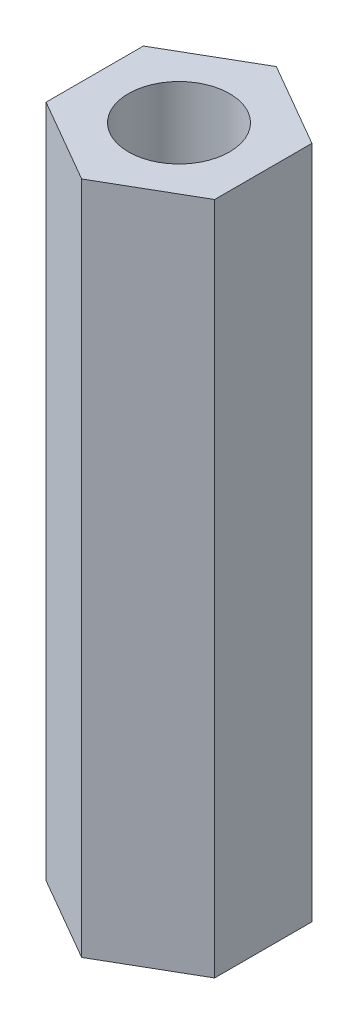
from build123d import *

# Parameters (mm, degrees)
EXTRUDE_1_DEPTH     = 20
CUT_EXTRUDE_1_REACH = 22.361
SKETCH_2_R          = 1.5


with BuildPart() as part:
    # 草圖1 → 填料-伸長1 (new body)
    with BuildSketch(Plane(origin=(0, 0, 0), x_dir=(1, 0, 0), z_dir=(0, 1, 0))):
        Polygon((0, 2.886751346), (-2.5, 1.443375673), (-2.5, -1.443375673), (0, -2.886751346), (2.5, -1.443375673), (2.5, 1.443375673), align=None)
    extrude(amount=EXTRUDE_1_DEPTH)

    # 草圖2 → 除料-伸長1 (cut, up to next)
    with BuildSketch(Plane(origin=(0, 20, 0), x_dir=(-1, 0, 0), z_dir=(0, 1, 0)), mode=Mode.PRIVATE) as cut_extrude_1_sk1:
        with Locations(Location((0, 0, 0), (0, 0, 90))):
            Circle(SKETCH_2_R)
    cut_extrude_1_tool1 = extrude(cut_extrude_1_sk1.sketch, amount=-CUT_EXTRUDE_1_REACH, mode=Mode.PRIVATE) & part.part
    add(cut_extrude_1_tool1.solids().sort_by_distance((0, 20, 0))[0], mode=Mode.SUBTRACT)


solid = part.part
